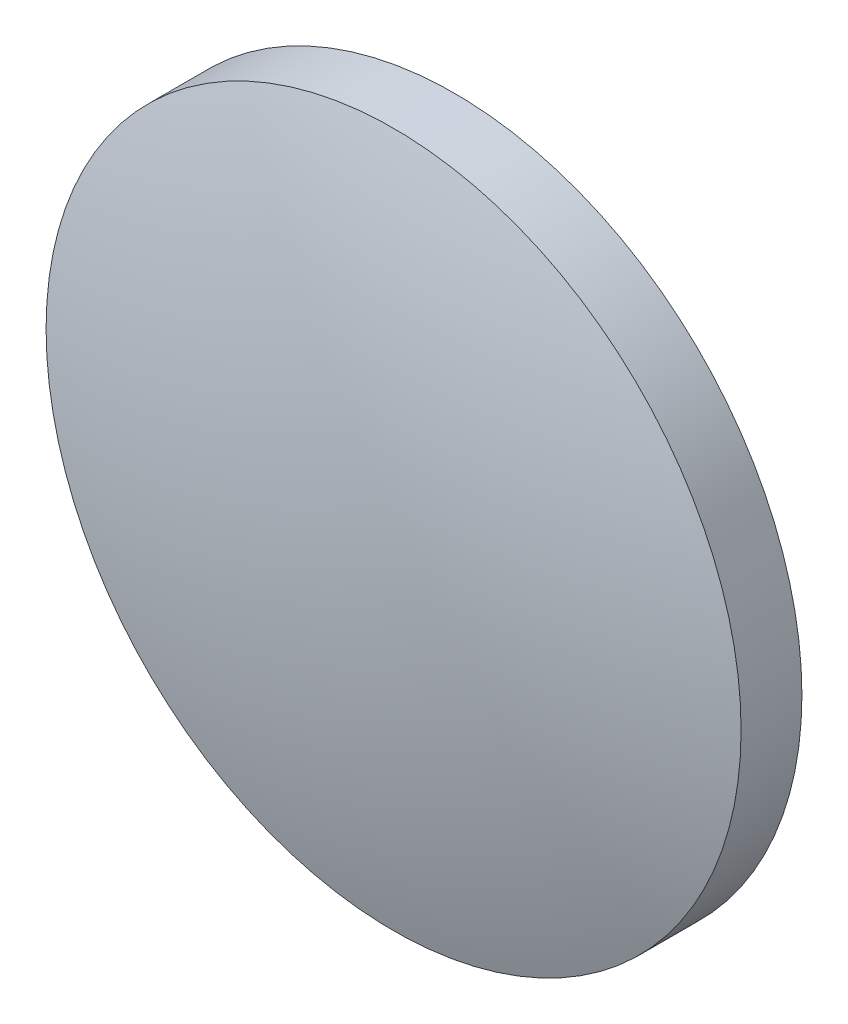
from build123d import *
from build123d.topology import SkipClean

# Parameters (mm, degrees)
SKETCH1_R               = 20
BOSS_EXTRUDE1_DEPTH     = 2
CUT_EXTRUDE1_DEPTH      = 149.939533232
CUT_EXTRUDE1_DEPTH_BACK = 149.939533232
SKETCH4_R               = 20
BOSS_EXTRUDE2_DEPTH     = 2
CUT_EXTRUDE2_DEPTH      = 60.117570106
CUT_EXTRUDE2_DEPTH_BACK = 60.117570106
BOSS_EXTRUDE3_START     = 1.5
SKETCH6_R               = 20
BOSS_EXTRUDE3_DEPTH     = 1.5


with BuildPart() as part:
    # Sketch1 → Boss-Extrude1 (new body)
    with BuildSketch(Plane.XY):
        Circle(SKETCH1_R)
    extrude(amount=BOSS_EXTRUDE1_DEPTH)

    # Sketch2 → Revolve1 (revolve)
    with BuildSketch(Plane(origin=(0, 0, 0), x_dir=(0, 0, -1), z_dir=(1, 0, 0))):
        with BuildLine():
            Line((-2, 20), (-2, -20))
            ThreePointArc((-2, -20), (-5.007692763, 0), (-2, 20))
        make_face()
    revolve(axis=Axis((0, 18.147187934, -62.992307237), (0, -1, 0)))

    # Sketch3 → Cut-Extrude1 (cut, two sides: drawn at the far end of the back side and taken through both)
    with BuildSketch(Plane(origin=(0, 0, 0), x_dir=(1, 0, 0), z_dir=(0, 1, 0)).offset(-CUT_EXTRUDE1_DEPTH_BACK)):
        Polygon((76.406042556, 19.358854798), (-76.406042556, 19.358854798), (-76.406042556, 108.879477381), (-76.406042556, 197.624528818), (96.484941814, 197.624528818), (96.484941814, 108.879477381), (76.406042556, 108.879477381), align=None)
    extrude(amount=CUT_EXTRUDE1_DEPTH + CUT_EXTRUDE1_DEPTH_BACK, mode=Mode.SUBTRACT)

    # Sketch4 → Boss-Extrude2 (add)
    with BuildSketch(Plane(origin=(0, 0, 0), x_dir=(-1, 0, 0), z_dir=(0, 0, -1))):
        Circle(SKETCH4_R)
    extrude(amount=-BOSS_EXTRUDE2_DEPTH)

    # Sketch5 → Cut-Extrude2 (cut, two sides: drawn at the far end of the back side and taken through both)
    with SkipClean():  # the faces are left unmerged after this step: merging them gives an invalid solid
        with BuildSketch(Plane(origin=(0, 0, 0), x_dir=(-1, 0, 0), z_dir=(0, 0, -1)).offset(-CUT_EXTRUDE2_DEPTH_BACK)):
            with BuildLine():
                ThreePointArc((-15.999038376, 12.001282059), (-8.94355521, 17.888902152), (-4.9e-08, 20))
                Line((-4.9e-08, 20), (-70.945492499, 20))
                Line((-70.945492499, 20), (-70.945492499, -20))
                Line((-70.945492499, -20), (2.6e-08, -20))
                ThreePointArc((2.6e-08, -20), (-8.943555177, -17.888902169), (-15.999038376, -12.001282059))
                ThreePointArc((-15.999038376, -12.001282059), (-20, 0), (-15.999038376, 12.001282059))
            make_face()
            with BuildLine():
                Line((70.945492499, -20), (70.945492499, 20))
                Line((70.945492499, 20), (-4.9e-08, 20))
                ThreePointArc((-4.9e-08, 20), (8.943555167, 17.888902174), (15.999038376, 12.001282059))
                ThreePointArc((15.999038376, 12.001282059), (18.973412549, 6.325315505), (20, 0))
                ThreePointArc((20, 0), (18.973412549, -6.325315505), (15.999038376, -12.001282059))
                ThreePointArc((15.999038376, -12.001282059), (8.9435552, -17.888902157), (2.6e-08, -20))
                Line((2.6e-08, -20), (70.945492499, -20))
            make_face()
        extrude(amount=CUT_EXTRUDE2_DEPTH + CUT_EXTRUDE2_DEPTH_BACK, mode=Mode.SUBTRACT)

    # Sketch6 → Boss-Extrude3 (add)
    with SkipClean():  # the faces are left unmerged after this step: merging them gives an invalid solid
        with BuildSketch(Plane(origin=(0, 0, 0), x_dir=(-1, 0, 0), z_dir=(0, 0, -1)).offset(BOSS_EXTRUDE3_START)):
            Circle(SKETCH6_R)
        extrude(amount=-BOSS_EXTRUDE3_DEPTH)


solid = part.part
